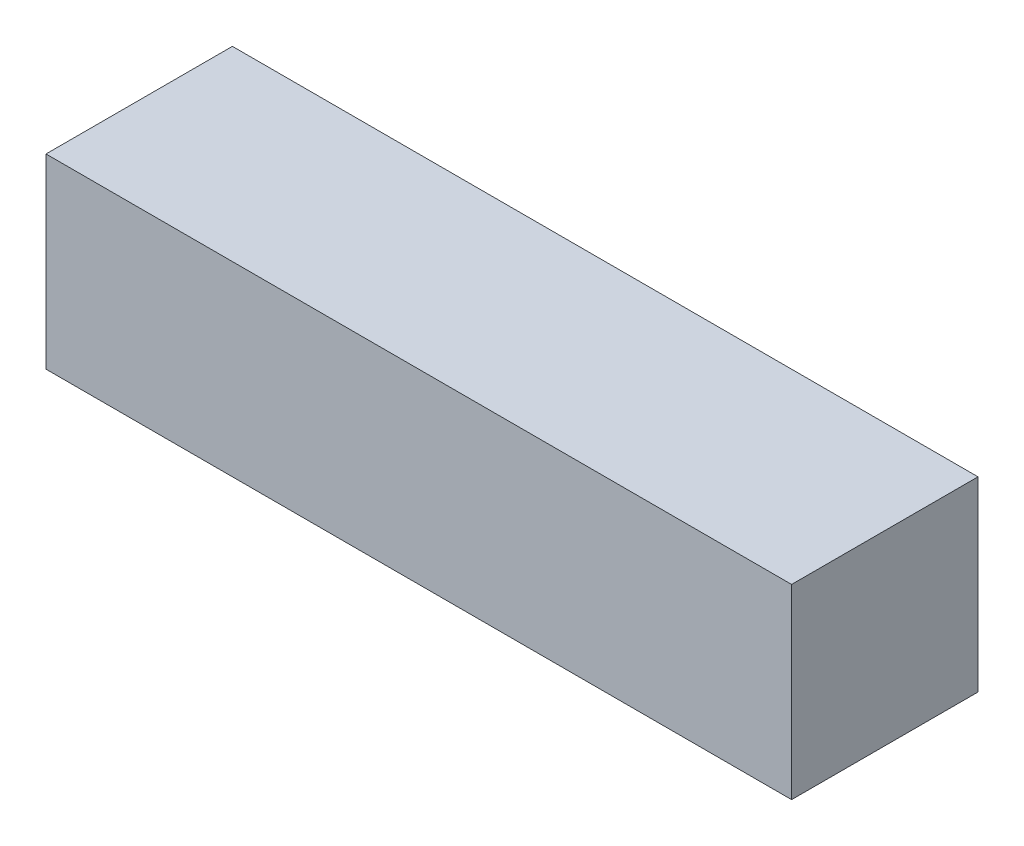
from build123d import *

# Parameters (mm, degrees)
SKETCH1_W           = 9.525
SKETCH1_H           = 9.525
BOSS_EXTRUDE1_DEPTH = 19.05


with BuildPart() as part:
    # Sketch1 → Boss-Extrude1 (new, symmetric)
    with BuildSketch(Plane(origin=(0, 0, 0), x_dir=(0, 0, -1), z_dir=(1, 0, 0))):
        Rectangle(SKETCH1_W, SKETCH1_H)
    extrude(amount=BOSS_EXTRUDE1_DEPTH, both=True)


solid = part.part
